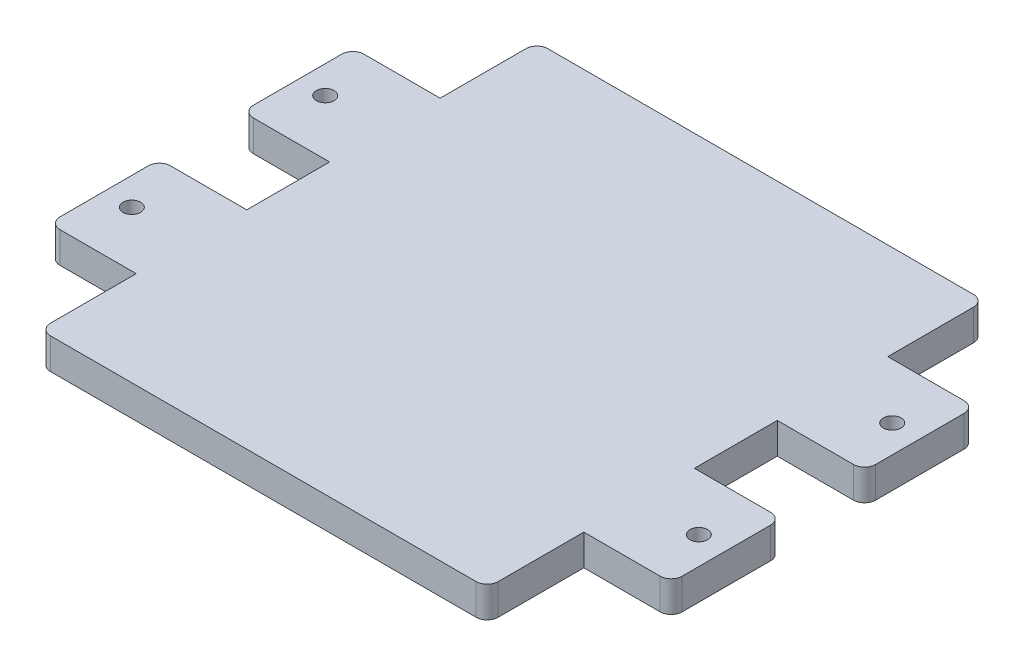
from build123d import *

# Parameters (mm, degrees)
SKETCH_1_W      = 81
SKETCH_1_H      = 90
EXTRUDE_1_DEPTH = 5.6
SKETCH_2_W      = 15.8
SKETCH_2_H      = 20
SKETCH_2_R      = 1.6
EXTRUDE_2_DEPTH = 5.6
FILLET_1_R      = 2


with BuildPart() as part:
    # ｽｹｯﾁ1 → ﾎﾞｽ - 押し出し1 (new body)
    with BuildSketch(Plane(origin=(0, 0, 0), x_dir=(1, 0, 0), z_dir=(0, 1, 0))):
        Rectangle(SKETCH_1_W, SKETCH_1_H)
    extrude(amount=EXTRUDE_1_DEPTH)

    # ｽｹｯﾁ2 → ﾎﾞｽ - 押し出し2 (add)
    # profile 1 of 4: a face of its own
    with BuildSketch(Plane(origin=(0, 5.6, 0), x_dir=(1, 0, 0), z_dir=(0, 1, 0))):
        with Locations((-48.4, 17.5)):
            Rectangle(SKETCH_2_W, SKETCH_2_H)
        with Locations(Location((-51.3, 17.5, 0), (0, 0, 270))):
            Circle(SKETCH_2_R, mode=Mode.SUBTRACT)
    # profile 2 of 4: a face of its own
    with BuildSketch(Plane(origin=(0, 5.6, 0), x_dir=(1, 0, 0), z_dir=(0, 1, 0))):
        with Locations((48.4, 17.5)):
            Rectangle(SKETCH_2_W, SKETCH_2_H)
        with Locations(Location((51.3, 17.5, 0), (0, 0, 90))):
            Circle(SKETCH_2_R, mode=Mode.SUBTRACT)
    # profile 3 of 4: a face of its own
    with BuildSketch(Plane(origin=(0, 5.6, 0), x_dir=(1, 0, 0), z_dir=(0, 1, 0))):
        with Locations((-48.4, -17.5)):
            Rectangle(SKETCH_2_W, SKETCH_2_H)
        with Locations(Location((-51.3, -17.5, 0), (0, 0, 90))):
            Circle(SKETCH_2_R, mode=Mode.SUBTRACT)
    # profile 4 of 4: a face of its own
    with BuildSketch(Plane(origin=(0, 5.6, 0), x_dir=(1, 0, 0), z_dir=(0, 1, 0))):
        with Locations((48.4, -17.5)):
            Rectangle(SKETCH_2_W, SKETCH_2_H)
        with Locations(Location((51.3, -17.5, 0), (0, 0, 270))):
            Circle(SKETCH_2_R, mode=Mode.SUBTRACT)
    extrude(amount=-EXTRUDE_2_DEPTH)

    # ﾌｨﾚｯﾄ1
    fillet_1_edges = [part.edges().sort_by_distance(p)[0] for p in [
        (56.3, 2.8, -27.5),
        (56.3, 2.8, -7.5),
        (-56.3, 2.8, -27.5),
        (-56.3, 2.8, -7.5),
        (-56.3, 2.8, 27.5),
        (-56.3, 2.8, 7.5),
        (56.3, 2.8, 27.5),
        (56.3, 2.8, 7.5),
        (40.5, 2.8, 45),
        (-40.5, 2.8, 45),
        (-40.5, 2.8, -45),
        (40.5, 2.8, -45),
    ]]
    fillet(fillet_1_edges, radius=FILLET_1_R)


solid = part.part
